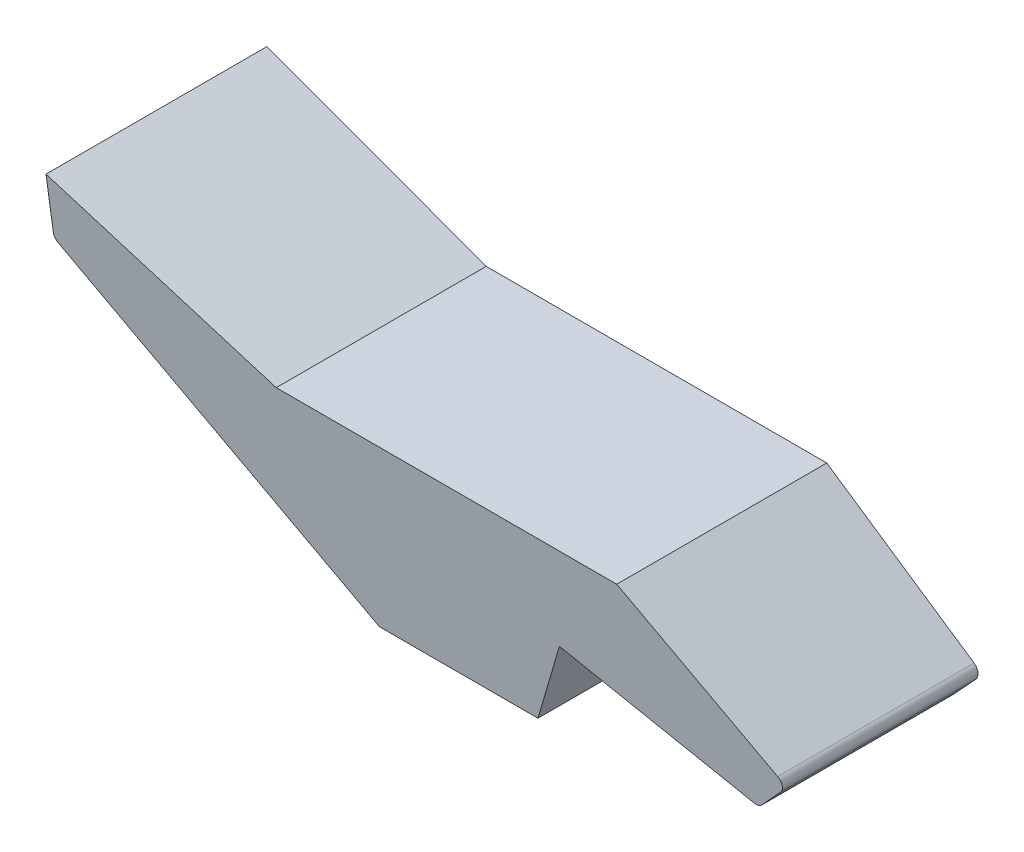
from build123d import *

# Parameters (mm, degrees)
BOSS_EXTRUDE1_DEPTH      = 20.6375
BOSS_EXTRUDE1_DEPTH_BACK = 19.05
SKETCH3_W                = 149.554059724
SKETCH3_H                = 74.48224525
CUT_EXTRUDE1_DEPTH       = 516.127884509


with BuildPart() as part:
    # Sketch1 → Boss-Extrude1 (new, two sides: drawn at the far end of the back side and taken through both)
    with BuildSketch(Plane.XY.offset(-BOSS_EXTRUDE1_DEPTH_BACK)):
        with BuildLine():
            Line((357.059535637, 173.035014711), (357.059535637, 163.261817954))
            ThreePointArc((357.059535637, 163.261817954), (357.244928479, 162.517337083), (357.75780558, 161.946741471))
            Line((357.75780558, 161.946741471), (410.584136752, 126.226566951))
            Line((410.584136752, 126.226566951), (439.063985597, 126.226566951))
            Line((439.063985597, 126.226566951), (444.978063494, 141.390869249))
            Line((444.978063494, 141.390869249), (478.819933038, 133.446768417))
            ThreePointArc((478.819933038, 133.446768417), (479.648013751, 133.474476416), (480.349350513, 133.915625085))
            Line((480.349350513, 133.915625085), (484.344651115, 138.244883468))
            ThreePointArc((484.344651115, 138.244883468), (484.754953748, 139.504412771), (484.067254744, 140.636593142))
            Line((484.067254744, 140.636593142), (457.603933076, 158.530595004))
            Line((457.603933076, 158.530595004), (396.440312316, 158.530595004))
            Line((396.440312316, 158.530595004), (357.059535637, 173.035014711))
        make_face()
    extrude(amount=BOSS_EXTRUDE1_DEPTH + BOSS_EXTRUDE1_DEPTH_BACK)

    # Sketch3 → Cut-Extrude1 (cut, through all)
    with BuildSketch(Plane(origin=(0, 0.377817836, -2.785049831), x_dir=(1, 0, 0), z_dir=(0, -0.13442794428844543, 0.9909233713029392))):
        with Locations((424.804234836, 142.512706275)):
            Rectangle(SKETCH3_W, SKETCH3_H)
    extrude(amount=CUT_EXTRUDE1_DEPTH, mode=Mode.SUBTRACT)


solid = part.part
